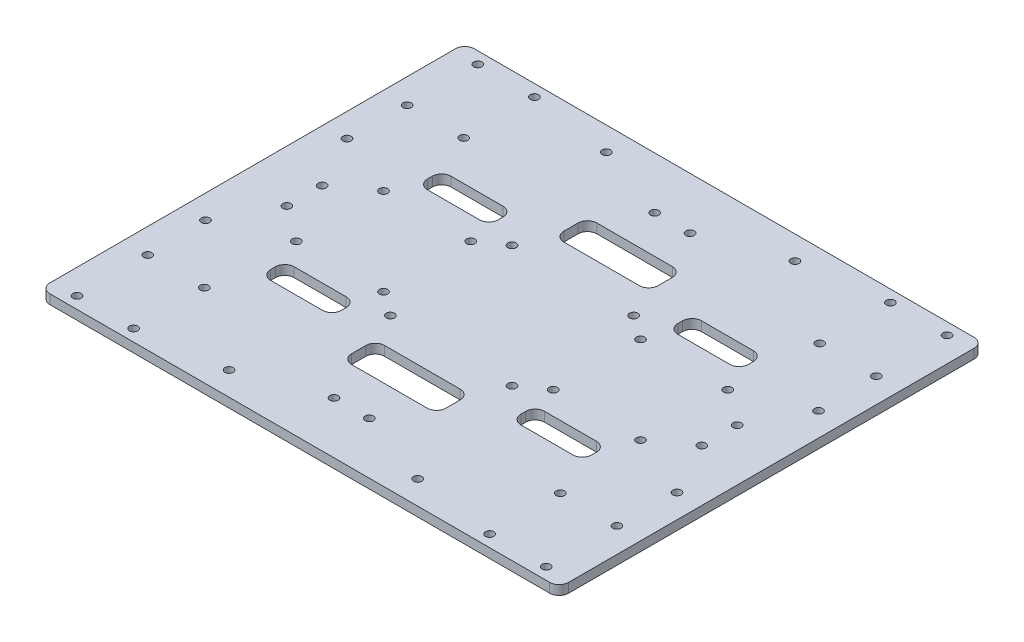
from build123d import *

# Parameters (mm, degrees)
SKETCH_1_W          = 220
SKETCH_1_H          = 180
EXTRUDE_1_DEPTH     = 4
SKETCH_3_R          = 1.75
CUT_EXTRUDE_2_DEPTH = 4
SKETCH_4_R          = 1.75
CUT_EXTRUDE_3_DEPTH = 4
SKETCH_5_R          = 1.75
CUT_EXTRUDE_4_DEPTH = 4
FILLET_1_R          = 4
SKETCH_6_W          = 40
SKETCH_6_H          = 14
SKETCH_6_W_2        = 30
SKETCH_6_H_2        = 10
CUT_EXTRUDE_5_DEPTH = 4
FILLET_2_R          = 4


with BuildPart() as part:
    # 草图1 → 凸台-拉伸1 (new body)
    with BuildSketch(Plane(origin=(0, 0, 0), x_dir=(1, 0, 0), z_dir=(0, 1, 0))):
        Rectangle(SKETCH_1_W, SKETCH_1_H)
    extrude(amount=EXTRUDE_1_DEPTH)

    # 草图3 → 切除-拉伸2 (cut)
    with BuildSketch(Plane.XZ):
        with Locations(Location((-99.5, -55, 0), (0, 0, 270))):
            Circle(SKETCH_3_R)
        with Locations(Location((-75.5, -55, 0), (0, 0, 270))):
            Circle(SKETCH_3_R)
        with Locations(Location((-99.5, -85, 0), (0, 0, 270))):
            Circle(SKETCH_3_R)
        with Locations(Location((-75.5, -85, 0), (0, 0, 270))):
            Circle(SKETCH_3_R)
        with Locations(Location((75.5, -55, 0), (0, 0, 270))):
            Circle(SKETCH_3_R)
        with Locations(Location((99.5, -55, 0), (0, 0, 270))):
            Circle(SKETCH_3_R)
        with Locations(Location((75.5, -85, 0), (0, 0, 270))):
            Circle(SKETCH_3_R)
        with Locations(Location((99.5, -85, 0), (0, 0, 270))):
            Circle(SKETCH_3_R)
        with Locations(Location((-99.5, 85, 0), (0, 0, 270))):
            Circle(SKETCH_3_R)
        with Locations(Location((-75.5, 85, 0), (0, 0, 270))):
            Circle(SKETCH_3_R)
        with Locations(Location((-99.5, 55, 0), (0, 0, 270))):
            Circle(SKETCH_3_R)
        with Locations(Location((-75.5, 55, 0), (0, 0, 270))):
            Circle(SKETCH_3_R)
        with Locations(Location((75.5, 85, 0), (0, 0, 270))):
            Circle(SKETCH_3_R)
        with Locations(Location((99.5, 85, 0), (0, 0, 270))):
            Circle(SKETCH_3_R)
        with Locations(Location((75.5, 55, 0), (0, 0, 270))):
            Circle(SKETCH_3_R)
        with Locations(Location((99.5, 55, 0), (0, 0, 270))):
            Circle(SKETCH_3_R)
        with Locations(Location((-88, 7.5, 0), (0, 0, 270))):
            Circle(SKETCH_3_R)
        with Locations(Location((-88, -7.5, 0), (0, 0, 270))):
            Circle(SKETCH_3_R)
        with Locations(Location((-7.5, -68, 0), (0, 0, 270))):
            Circle(SKETCH_3_R)
        with Locations(Location((7.5, -68, 0), (0, 0, 270))):
            Circle(SKETCH_3_R)
        with Locations(Location((88, -7.5, 0), (0, 0, 270))):
            Circle(SKETCH_3_R)
        with Locations(Location((88, 7.5, 0), (0, 0, 270))):
            Circle(SKETCH_3_R)
        with Locations(Location((-7.5, 68, 0), (0, 0, 270))):
            Circle(SKETCH_3_R)
        with Locations(Location((7.5, 68, 0), (0, 0, 270))):
            Circle(SKETCH_3_R)
    extrude(amount=-CUT_EXTRUDE_2_DEPTH, mode=Mode.SUBTRACT)

    # 草图4 → 切除-拉伸3 (cut)
    with BuildSketch(Plane.XZ):
        with Locations(Location((-73, 18.5, 0), (0, 0, 270))):
            Circle(SKETCH_4_R)
        with Locations(Location((-36, 18.5, 0), (0, 0, 270))):
            Circle(SKETCH_4_R)
        with Locations(Location((-73, -18.5, 0), (0, 0, 270))):
            Circle(SKETCH_4_R)
        with Locations(Location((-36, -18.5, 0), (0, 0, 270))):
            Circle(SKETCH_4_R)
        with Locations(Location((36, 18.5, 0), (0, 0, 270))):
            Circle(SKETCH_4_R)
        with Locations(Location((73, 18.5, 0), (0, 0, 270))):
            Circle(SKETCH_4_R)
        with Locations(Location((36, -18.5, 0), (0, 0, 270))):
            Circle(SKETCH_4_R)
        with Locations(Location((73, -18.5, 0), (0, 0, 270))):
            Circle(SKETCH_4_R)
        with Locations(Location((-25.8, 25.8, 0), (0, 0, 270))):
            Circle(SKETCH_4_R)
        with Locations(Location((25.8, 25.8, 0), (0, 0, 270))):
            Circle(SKETCH_4_R)
        with Locations(Location((-25.8, -25.8, 0), (0, 0, 270))):
            Circle(SKETCH_4_R)
        with Locations(Location((25.8, -25.8, 0), (0, 0, 270))):
            Circle(SKETCH_4_R)
    extrude(amount=-CUT_EXTRUDE_3_DEPTH, mode=Mode.SUBTRACT)

    # 草图5 → 切除-拉伸4 (cut)
    with BuildSketch(Plane.XZ):
        with Locations(Location((-40, 80, 0), (0, 0, 270))):
            Circle(SKETCH_5_R)
        with Locations(Location((40, 80, 0), (0, 0, 270))):
            Circle(SKETCH_5_R)
        with Locations(Location((100, 30, 0), (0, 0, 270))):
            Circle(SKETCH_5_R)
        with Locations(Location((100, -30, 0), (0, 0, 270))):
            Circle(SKETCH_5_R)
        with Locations(Location((40, -80, 0), (0, 0, 270))):
            Circle(SKETCH_5_R)
        with Locations(Location((-40, -80, 0), (0, 0, 270))):
            Circle(SKETCH_5_R)
        with Locations(Location((-100, -30, 0), (0, 0, 270))):
            Circle(SKETCH_5_R)
        with Locations(Location((-100, 30, 0), (0, 0, 270))):
            Circle(SKETCH_5_R)
    extrude(amount=-CUT_EXTRUDE_4_DEPTH, mode=Mode.SUBTRACT)

    # 圆角1
    fillet_1_edges = [part.edges().sort_by_distance(p)[0] for p in [
        (-110, 2, -90),
        (110, 2, -90),
        (110, 2, 90),
        (-110, 2, 90),
    ]]
    fillet(fillet_1_edges, radius=FILLET_1_R)

    # 草图6 → 切除-拉伸5 (cut)
    with BuildSketch(Plane.XZ):
        with Locations((0, 45)):
            Rectangle(SKETCH_6_W, SKETCH_6_H)
        with Locations((-53.094123813, 33.26992324)):
            Rectangle(SKETCH_6_W_2, SKETCH_6_H_2)
        with Locations((53.094123813, 33.26992324)):
            Rectangle(SKETCH_6_W_2, SKETCH_6_H_2)
        with Locations((53.094123813, -33.26992324)):
            Rectangle(SKETCH_6_W_2, SKETCH_6_H_2)
        with Locations((-53.094123813, -33.26992324)):
            Rectangle(SKETCH_6_W_2, SKETCH_6_H_2)
        with Locations((0, -45)):
            Rectangle(SKETCH_6_W, SKETCH_6_H)
    extrude(amount=-CUT_EXTRUDE_5_DEPTH, mode=Mode.SUBTRACT)

    # 圆角2
    fillet_2_edges = [part.edges().sort_by_distance(p)[0] for p in [
        (-38.094123813, 2, 38.26992324),
        (-38.094123813, 2, 28.26992324),
        (-68.094123813, 2, 28.26992324),
        (-68.094123813, 2, 38.26992324),
        (68.094123813, 2, 38.26992324),
        (68.094123813, 2, 28.26992324),
        (38.094123813, 2, 28.26992324),
        (38.094123813, 2, 38.26992324),
        (68.094123813, 2, -28.26992324),
        (68.094123813, 2, -38.26992324),
        (38.094123813, 2, -38.26992324),
        (38.094123813, 2, -28.26992324),
        (-68.094123813, 2, -38.26992324),
        (-68.094123813, 2, -28.26992324),
        (-38.094123813, 2, -28.26992324),
        (-38.094123813, 2, -38.26992324),
        (-20, 2, -52),
        (-20, 2, -38),
        (20, 2, -38),
        (20, 2, -52),
        (20, 2, 52),
        (20, 2, 38),
        (-20, 2, 38),
        (-20, 2, 52),
    ]]
    fillet(fillet_2_edges, radius=FILLET_2_R)


solid = part.part
